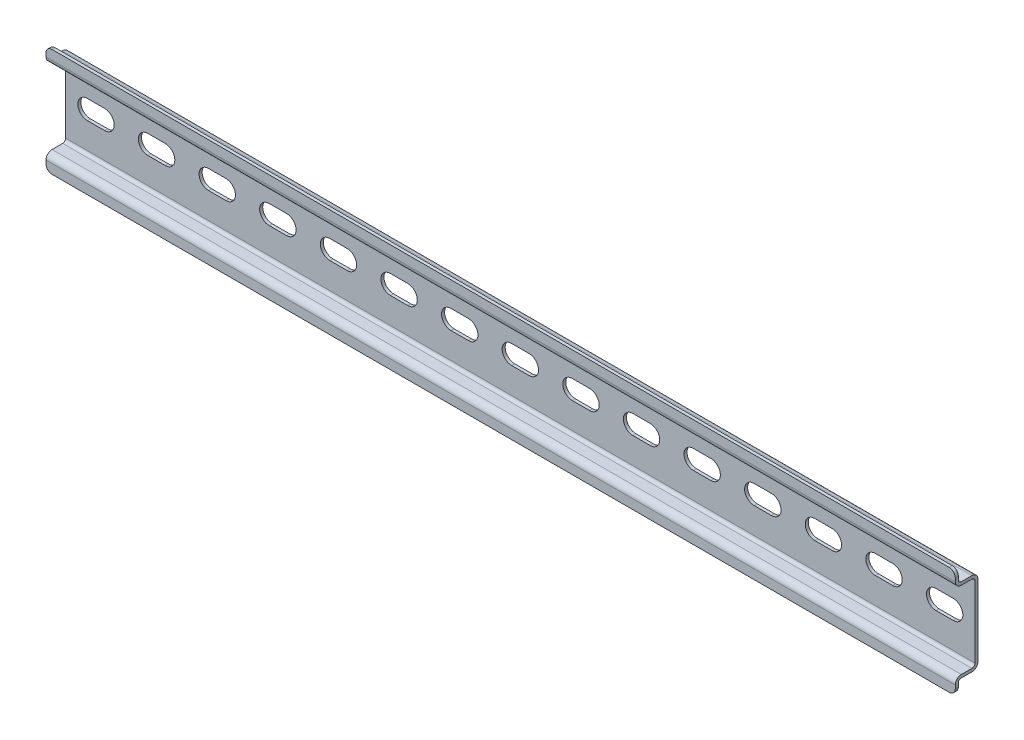
from build123d import *

# Parameters (mm, degrees)
BOSS_EXTRUDE1_DEPTH = 300
CUT_EXTRUDE1_DEPTH  = 303.20976159
LPATTERN1_COUNT     = 15
LPATTERN1_PITCH     = 20
FILLET1_R           = 2


with BuildPart() as part:
    # Sketch1 → Boss-Extrude1 (new body)
    with BuildSketch(Plane(origin=(0, 0, 0), x_dir=(0, 0, -1), z_dir=(1, 0, 0))):
        with BuildLine():
            Line((0, 0), (0, 3.1))
            ThreePointArc((0, 3.1), (0.585786438, 4.514213562), (2, 5.1))
            Line((2, 5.1), (5.5, 5.1))
            ThreePointArc((5.5, 5.1), (6.207106781, 5.392893219), (6.5, 6.1))
            Line((6.5, 6.1), (6.5, 29.6))
            ThreePointArc((6.5, 29.6), (6.207106781, 30.307106781), (5.5, 30.6))
            Line((5.5, 30.6), (2, 30.6))
            ThreePointArc((2, 30.6), (0.585786438, 31.185786438), (0, 32.6))
            Line((0, 32.6), (0, 35.7))
            Line((0, 35.7), (1, 35.7))
            Line((1, 35.7), (1, 32.6))
            ThreePointArc((1, 32.6), (1.292893219, 31.892893219), (2, 31.6))
            Line((2, 31.6), (5.5, 31.6))
            ThreePointArc((5.5, 31.6), (6.914213562, 31.014213562), (7.5, 29.6))
            Line((7.5, 29.6), (7.5, 6.1))
            ThreePointArc((7.5, 6.1), (6.914213562, 4.685786438), (5.5, 4.1))
            Line((5.5, 4.1), (2, 4.1))
            ThreePointArc((2, 4.1), (1.292893219, 3.807106781), (1, 3.1))
            Line((1, 3.1), (1, 0))
            Line((1, 0), (0, 0))
        make_face()
    extrude(amount=BOSS_EXTRUDE1_DEPTH)

    # Sketch2 → Cut-Extrude1 (cut, through all)
    with BuildSketch(Plane.XY):
        with BuildLine():
            Line((7.15, 21), (12.85, 21))
            ThreePointArc((12.85, 21), (16, 17.85), (12.85, 14.7))
            Line((12.85, 14.7), (7.15, 14.7))
            ThreePointArc((7.15, 14.7), (4, 17.85), (7.15, 21))
        make_face()
    cut_extrude1 = extrude(amount=-CUT_EXTRUDE1_DEPTH, mode=Mode.SUBTRACT)

    # LPattern1: Cut-Extrude1 ×15
    with Locations(*[(i * LPATTERN1_PITCH, 0, 0) for i in range(1, LPATTERN1_COUNT)]):
        add(cut_extrude1, mode=Mode.SUBTRACT)

    # Fillet1
    fillet1_edges = [part.edges().sort_by_distance(p)[0] for p in [
        (0, 35.7, -0.5),
        (0, 0, -0.5),
        (300, 35.7, -0.5),
        (300, 0, -0.5),
    ]]
    fillet(fillet1_edges, radius=FILLET1_R)


solid = part.part
